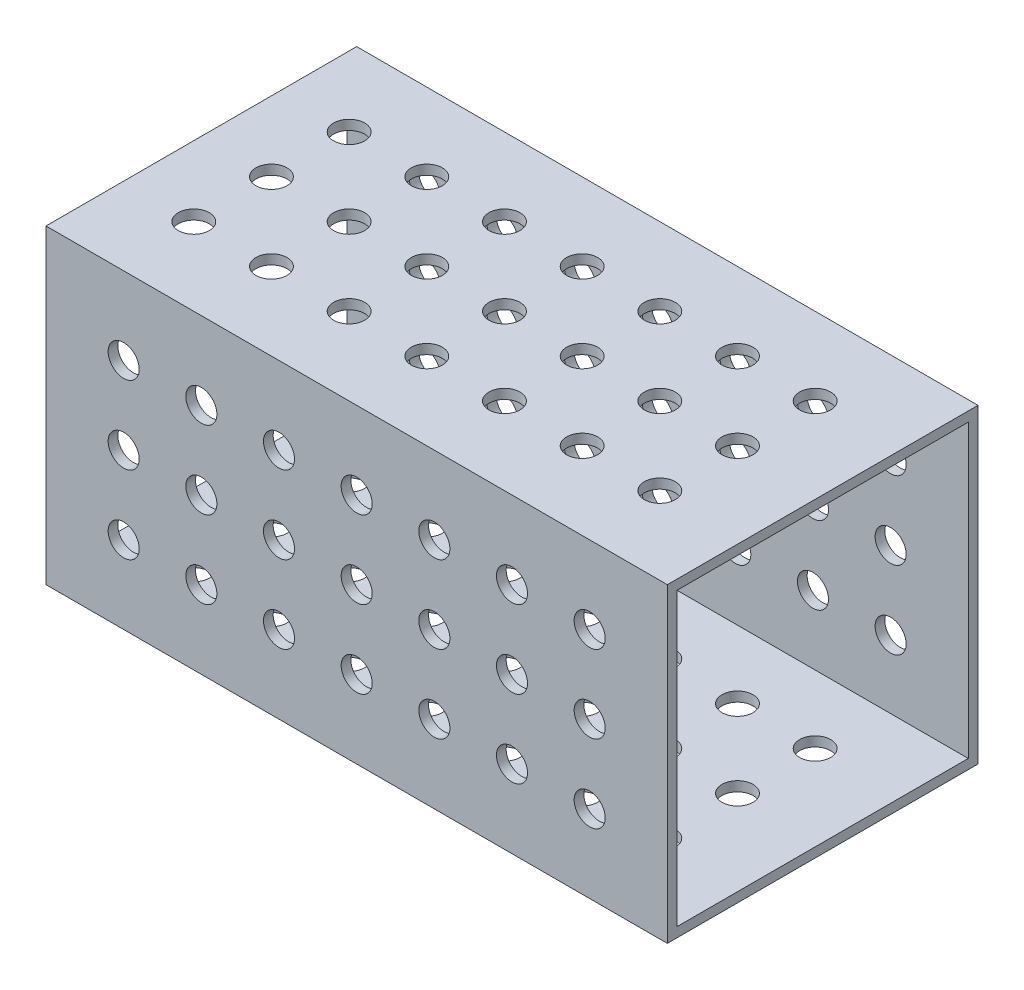
from build123d import *

# Parameters (mm, degrees)
SKETCH1_W           = 50.8
SKETCH1_H           = 50.8
SKETCH1_W_2         = 47.625
SKETCH1_H_2         = 47.625
BOSS_EXTRUDE1_DEPTH = 101.6
SKETCH2_R           = 2.54
CUT_EXTRUDE2_DEPTH  = 609.6
SKETCH3_R           = 2.54
CUT_EXTRUDE3_DEPTH  = 76.2


with BuildPart() as part:
    # Sketch1 → Boss-Extrude1 (new body)
    with BuildSketch(Plane(origin=(0, 0, 0), x_dir=(0, 0, -1), z_dir=(1, 0, 0))):
        Rectangle(SKETCH1_W, SKETCH1_H)
        Rectangle(SKETCH1_W_2, SKETCH1_H_2, mode=Mode.SUBTRACT)
    extrude(amount=BOSS_EXTRUDE1_DEPTH)

    # Sketch2 → Cut-Extrude2 (cut)
    with BuildSketch(Plane.XY.offset(25.4)):
        with Locations((12.7, 12.7)):
            Circle(SKETCH2_R)
        with Locations((12.7, 0)):
            Circle(SKETCH2_R)
        with Locations((12.7, -12.7)):
            Circle(SKETCH2_R)
        with Locations((25.4, 12.7)):
            Circle(SKETCH2_R)
        with Locations((25.4, 0)):
            Circle(SKETCH2_R)
        with Locations((25.4, -12.7)):
            Circle(SKETCH2_R)
        with Locations((38.1, 12.7)):
            Circle(SKETCH2_R)
        with Locations((38.1, 0)):
            Circle(SKETCH2_R)
        with Locations((38.1, -12.7)):
            Circle(SKETCH2_R)
        with Locations((50.8, 12.7)):
            Circle(SKETCH2_R)
        with Locations((50.8, 0)):
            Circle(SKETCH2_R)
        with Locations((50.8, -12.7)):
            Circle(SKETCH2_R)
        with Locations((63.5, 12.7)):
            Circle(SKETCH2_R)
        with Locations((63.5, 0)):
            Circle(SKETCH2_R)
        with Locations((63.5, -12.7)):
            Circle(SKETCH2_R)
        with Locations((76.2, 12.7)):
            Circle(SKETCH2_R)
        with Locations((76.2, 0)):
            Circle(SKETCH2_R)
        with Locations((76.2, -12.7)):
            Circle(SKETCH2_R)
        with Locations((88.9, 12.7)):
            Circle(SKETCH2_R)
        with Locations((88.9, 0)):
            Circle(SKETCH2_R)
        with Locations((88.9, -12.7)):
            Circle(SKETCH2_R)
    extrude(amount=-CUT_EXTRUDE2_DEPTH, mode=Mode.SUBTRACT)

    # Sketch3 → Cut-Extrude3 (cut)
    with BuildSketch(Plane.XZ.offset(25.4)):
        with Locations(Location((11.466852122, 12.7, 0), (0, 0, 270))):
            Circle(SKETCH3_R)
        with Locations(Location((11.466852122, 0, 0), (0, 0, 270))):
            Circle(SKETCH3_R)
        with Locations(Location((11.471230502, -12.699999245, 0), (0, 0, 270))):
            Circle(SKETCH3_R)
        with Locations(Location((24.166852122, 12.699999245, 0), (0, 0, 270))):
            Circle(SKETCH3_R)
        with Locations(Location((24.166852122, -7.55e-07, 0), (0, 0, 270))):
            Circle(SKETCH3_R)
        with Locations(Location((24.171230502, -12.7, 0), (0, 0, 270))):
            Circle(SKETCH3_R)
        with Locations(Location((36.866852122, 12.699999245, 0), (0, 0, 270))):
            Circle(SKETCH3_R)
        with Locations(Location((36.871230502, 0, 0), (0, 0, 270))):
            Circle(SKETCH3_R)
        with Locations(Location((36.871230502, -12.7, 0), (0, 0, 270))):
            Circle(SKETCH3_R)
        with Locations(Location((49.566852122, 12.699999245, 0), (0, 0, 270))):
            Circle(SKETCH3_R)
        with Locations(Location((49.571230502, 0, 0), (0, 0, 270))):
            Circle(SKETCH3_R)
        with Locations(Location((49.571230502, -12.7, 0), (0, 0, 270))):
            Circle(SKETCH3_R)
        with Locations(Location((62.266852122, 12.699999245, 0), (0, 0, 270))):
            Circle(SKETCH3_R)
        with Locations(Location((62.271230502, 0, 0), (0, 0, 270))):
            Circle(SKETCH3_R)
        with Locations(Location((62.271230502, -12.7, 0), (0, 0, 270))):
            Circle(SKETCH3_R)
        with Locations(Location((74.966852122, 12.699999245, 0), (0, 0, 270))):
            Circle(SKETCH3_R)
        with Locations(Location((74.971230502, 0, 0), (0, 0, 270))):
            Circle(SKETCH3_R)
        with Locations(Location((74.971230502, -12.7, 0), (0, 0, 270))):
            Circle(SKETCH3_R)
        with Locations(Location((87.671230502, 12.7, 0), (0, 0, 270))):
            Circle(SKETCH3_R)
        with Locations(Location((87.671230502, 0, 0), (0, 0, 270))):
            Circle(SKETCH3_R)
        with Locations(Location((87.671230502, -12.7, 0), (0, 0, 270))):
            Circle(SKETCH3_R)
    extrude(amount=-CUT_EXTRUDE3_DEPTH, mode=Mode.SUBTRACT)


solid = part.part
